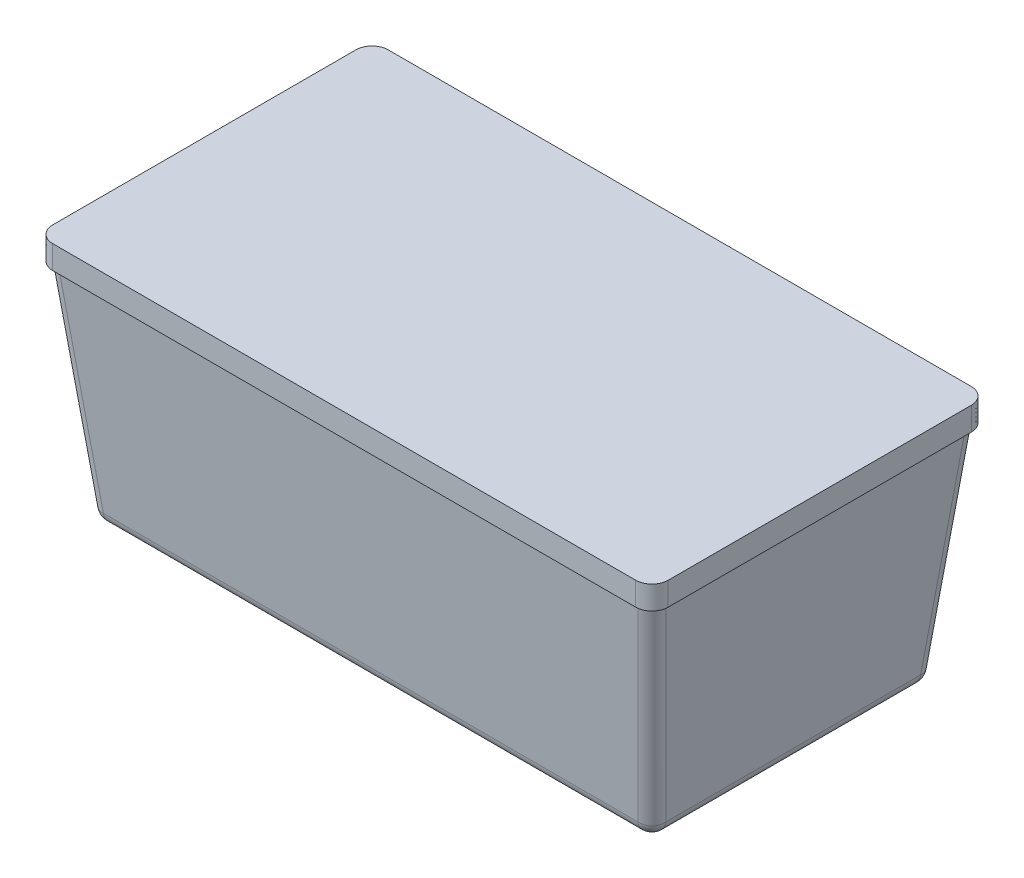
from build123d import *

# Parameters (mm, degrees)
CROQUIS1_W     = 1200
CROQUIS1_H     = 600
EXTRUIR1_DEPTH = 520
EXTRUIR1_DRAFT = -6
REDONDEO1_R    = 30
VACIADO1_T     = -10
EXTRUIR2_DEPTH = 40
EXTRUIR3_DEPTH = 10


with BuildPart() as part:
    # Croquis1 → Extruir1 (with draft: the straight prism first)
    with BuildSketch(Plane(origin=(0, 0, 0), x_dir=(1, 0, 0), z_dir=(0, 1, 0))):
        Rectangle(CROQUIS1_W, CROQUIS1_H)
    extrude(amount=EXTRUIR1_DEPTH)
    # Extruir1: the draft: its side faces are tilted about the plane it starts from
    extruir1_sides = [part.faces().sort_by_distance(p)[0] for p in [
        (600, 260, 0),
        (0, 260, -300),
        (-600, 260, 0),
        (0, 260, 300),
    ]]
    draft(extruir1_sides, Plane(origin=(0, 0, 0), x_dir=(1, 0, 0), z_dir=(0, 1, 0)), EXTRUIR1_DRAFT)

    # Redondeo1
    redondeo1_edges = [part.edges().sort_by_distance(p)[0] for p in [
        (0, 0, -300),
        (600, 0, 0),
        (0, 0, 300),
        (-600, 0, 0),
        (-627.327101169, 260, -327.327101169),
        (627.327101169, 260, -327.327101169),
        (627.327101169, 260, 327.327101169),
        (-627.327101169, 260, 327.327101169),
    ]]
    fillet(redondeo1_edges, radius=REDONDEO1_R)

    # Vaciado1
    vaciado1_openings = [part.faces().sort_by_distance(p)[0] for p in [
        (0, 520, 0),
    ]]
    offset(amount=VACIADO1_T, openings=vaciado1_openings, kind=Kind.INTERSECTION)


with BuildPart() as body_2:
    # Croquis2 → Extruir2 (new body)
    with BuildSketch(Plane(origin=(0, 520, 0), x_dir=(1, 0, 0), z_dir=(0, 1, 0))):
        with BuildLine():
            Line((624.818545477, 359.654202338), (-624.818545477, 359.654202338))
            add(Edge.make_bspline(
                [(-624.818545477, 359.654202338), (-627.120086028, 359.654202338), (-629.380934681, 359.430411757), (-632.713747218, 358.773214804), (-633.814869933, 358.500171352), (-635.451518922, 358.007918705), (-635.994558337, 357.830029047), (-637.075507941, 357.446040848), (-637.613820315, 357.239674494), (-640.2615232, 356.148907719), (-642.265343116, 355.081190983), (-645.10317609, 353.193132085), (-646.020940364, 352.51569528), (-647.353923908, 351.425037779), (-647.790551127, 351.049250723), (-648.639460703, 350.281234378), (-649.053000136, 349.888002267), (-651.066995309, 347.87646125), (-652.507863424, 346.123294027), (-654.41183532, 343.276088185), (-655.005828534, 342.285067005), (-656.083159903, 340.267175368), (-656.568789235, 339.23798924), (-657.870403065, 336.091173443), (-658.532675254, 333.914517133), (-659.430368248, 329.399769105), (-659.654202338, 327.120197811), (-659.654202338, 324.818545477)],
                knots=[0, 0, 0, 0, 0.125, 0.125, 0.1875, 0.1875, 0.21875, 0.21875, 0.25, 0.25, 0.375, 0.375, 0.4375, 0.4375, 0.46875, 0.46875, 0.5, 0.5, 0.625, 0.625, 0.6875, 0.6875, 0.75, 0.75, 0.875, 0.875, 1, 1, 1, 1], degree=3))
            Line((-659.654202338, 324.818545477), (-659.654202338, -324.818545477))
            add(Edge.make_bspline(
                [(-659.654202338, -324.818545477), (-659.654202338, -327.120086028), (-659.430411757, -329.380934681), (-658.773214804, -332.713747218), (-658.500171352, -333.814869933), (-658.007918705, -335.451518922), (-657.830029047, -335.994558337), (-657.446040848, -337.075507941), (-657.239674494, -337.613820315), (-656.148907719, -340.2615232), (-655.081190983, -342.265343116), (-653.193132085, -345.10317609), (-652.51569528, -346.020940364), (-651.425037779, -347.353923908), (-651.049250723, -347.790551127), (-650.281234378, -348.639460703), (-649.888002267, -349.053000136), (-647.87646125, -351.066995309), (-646.123294027, -352.507863424), (-643.276088185, -354.41183532), (-642.285067005, -355.005828534), (-640.267175368, -356.083159903), (-639.23798924, -356.568789235), (-636.091173443, -357.870403065), (-633.914517133, -358.532675254), (-629.399769105, -359.430368248), (-627.120197811, -359.654202338), (-624.818545477, -359.654202338)],
                knots=[0, 0, 0, 0, 0.125, 0.125, 0.1875, 0.1875, 0.21875, 0.21875, 0.25, 0.25, 0.375, 0.375, 0.4375, 0.4375, 0.46875, 0.46875, 0.5, 0.5, 0.625, 0.625, 0.6875, 0.6875, 0.75, 0.75, 0.875, 0.875, 1, 1, 1, 1], degree=3))
            Line((-624.818545477, -359.654202338), (624.818545477, -359.654202338))
            add(Edge.make_bspline(
                [(624.818545477, -359.654202338), (627.120086028, -359.654202338), (629.380934681, -359.430411757), (632.713747218, -358.773214804), (633.814869933, -358.500171352), (635.451518922, -358.007918705), (635.994558337, -357.830029047), (637.075507941, -357.446040848), (637.613820315, -357.239674494), (640.2615232, -356.148907719), (642.265343116, -355.081190983), (645.10317609, -353.193132085), (646.020940364, -352.51569528), (647.353923908, -351.425037779), (647.790551127, -351.049250723), (648.639460703, -350.281234378), (649.053000136, -349.888002267), (651.066995309, -347.87646125), (652.507863424, -346.123294027), (654.41183532, -343.276088185), (655.005828534, -342.285067005), (656.083159903, -340.267175368), (656.568789235, -339.23798924), (657.870403065, -336.091173443), (658.532675254, -333.914517133), (659.430368248, -329.399769105), (659.654202338, -327.120197811), (659.654202338, -324.818545477)],
                knots=[0, 0, 0, 0, 0.125, 0.125, 0.1875, 0.1875, 0.21875, 0.21875, 0.25, 0.25, 0.375, 0.375, 0.4375, 0.4375, 0.46875, 0.46875, 0.5, 0.5, 0.625, 0.625, 0.6875, 0.6875, 0.75, 0.75, 0.875, 0.875, 1, 1, 1, 1], degree=3))
            Line((659.654202338, -324.818545477), (659.654202338, 324.818545477))
            add(Edge.make_bspline(
                [(659.654202338, 324.818545477), (659.654202338, 327.120086028), (659.430411757, 329.380934681), (658.773214804, 332.713747218), (658.500171352, 333.814869933), (658.007918705, 335.451518922), (657.830029047, 335.994558337), (657.446040848, 337.075507941), (657.239674494, 337.613820315), (656.148907719, 340.2615232), (655.081190983, 342.265343116), (653.193132085, 345.10317609), (652.51569528, 346.020940364), (651.425037779, 347.353923908), (651.049250723, 347.790551127), (650.281234378, 348.639460703), (649.888002267, 349.053000136), (647.87646125, 351.066995309), (646.123294027, 352.507863424), (643.276088185, 354.41183532), (642.285067005, 355.005828534), (640.267175368, 356.083159903), (639.23798924, 356.568789235), (636.091173443, 357.870403065), (633.914517133, 358.532675254), (629.399769105, 359.430368248), (627.120197811, 359.654202338), (624.818545477, 359.654202338)],
                knots=[0, 0, 0, 0, 0.125, 0.125, 0.1875, 0.1875, 0.21875, 0.21875, 0.25, 0.25, 0.375, 0.375, 0.4375, 0.4375, 0.46875, 0.46875, 0.5, 0.5, 0.625, 0.625, 0.6875, 0.6875, 0.75, 0.75, 0.875, 0.875, 1, 1, 1, 1], degree=3))
        make_face()
    extrude(amount=-EXTRUIR2_DEPTH)

    # Croquis3 → Extruir3 (add)
    with BuildSketch(Plane(origin=(0, 520, 0), x_dir=(1, 0, 0), z_dir=(0, 1, 0))):
        with BuildLine():
            Line((-659.654202338, 324.818545477), (-659.654202338, -324.818545477))
            add(Edge.make_bspline(
                [(-659.654202338, -324.818545477), (-659.654202338, -327.120086028), (-659.430411757, -329.380934681), (-658.773214804, -332.713747218), (-658.500171352, -333.814869933), (-658.007918705, -335.451518922), (-657.830029047, -335.994558337), (-657.446040848, -337.075507941), (-657.239674494, -337.613820315), (-656.148907719, -340.2615232), (-655.081190983, -342.265343116), (-653.193132085, -345.10317609), (-652.51569528, -346.020940364), (-651.425037779, -347.353923908), (-651.049250723, -347.790551127), (-650.281234378, -348.639460703), (-649.888002267, -349.053000136), (-647.87646125, -351.066995309), (-646.123294027, -352.507863424), (-643.276088185, -354.41183532), (-642.285067005, -355.005828534), (-640.267175368, -356.083159903), (-639.23798924, -356.568789235), (-636.091173443, -357.870403065), (-633.914517133, -358.532675254), (-629.399769105, -359.430368248), (-627.120197811, -359.654202338), (-624.818545477, -359.654202338)],
                knots=[0, 0, 0, 0, 0.125, 0.125, 0.1875, 0.1875, 0.21875, 0.21875, 0.25, 0.25, 0.375, 0.375, 0.4375, 0.4375, 0.46875, 0.46875, 0.5, 0.5, 0.625, 0.625, 0.6875, 0.6875, 0.75, 0.75, 0.875, 0.875, 1, 1, 1, 1], degree=3))
            Line((-624.818545477, -359.654202338), (624.818545477, -359.654202338))
            add(Edge.make_bspline(
                [(624.818545477, -359.654202338), (627.120086028, -359.654202338), (629.380934681, -359.430411757), (632.713747218, -358.773214804), (633.814869933, -358.500171352), (635.451518922, -358.007918705), (635.994558337, -357.830029047), (637.075507941, -357.446040848), (637.613820315, -357.239674494), (640.2615232, -356.148907719), (642.265343116, -355.081190983), (645.10317609, -353.193132085), (646.020940364, -352.51569528), (647.353923908, -351.425037779), (647.790551127, -351.049250723), (648.639460703, -350.281234378), (649.053000136, -349.888002267), (651.066995309, -347.87646125), (652.507863424, -346.123294027), (654.41183532, -343.276088185), (655.005828534, -342.285067005), (656.083159903, -340.267175368), (656.568789235, -339.23798924), (657.870403065, -336.091173443), (658.532675254, -333.914517133), (659.430368248, -329.399769105), (659.654202338, -327.120197811), (659.654202338, -324.818545477)],
                knots=[0, 0, 0, 0, 0.125, 0.125, 0.1875, 0.1875, 0.21875, 0.21875, 0.25, 0.25, 0.375, 0.375, 0.4375, 0.4375, 0.46875, 0.46875, 0.5, 0.5, 0.625, 0.625, 0.6875, 0.6875, 0.75, 0.75, 0.875, 0.875, 1, 1, 1, 1], degree=3))
            Line((659.654202338, -324.818545477), (659.654202338, 324.818545477))
            add(Edge.make_bspline(
                [(659.654202338, 324.818545477), (659.654202338, 327.120086028), (659.430411757, 329.380934681), (658.773214804, 332.713747218), (658.500171352, 333.814869933), (658.007918705, 335.451518922), (657.830029047, 335.994558337), (657.446040848, 337.075507941), (657.239674494, 337.613820315), (656.148907719, 340.2615232), (655.081190983, 342.265343116), (653.193132085, 345.10317609), (652.51569528, 346.020940364), (651.425037779, 347.353923908), (651.049250723, 347.790551127), (650.281234378, 348.639460703), (649.888002267, 349.053000136), (647.87646125, 351.066995309), (646.123294027, 352.507863424), (643.276088185, 354.41183532), (642.285067005, 355.005828534), (640.267175368, 356.083159903), (639.23798924, 356.568789235), (636.091173443, 357.870403065), (633.914517133, 358.532675254), (629.399769105, 359.430368248), (627.120197811, 359.654202338), (624.818545477, 359.654202338)],
                knots=[0, 0, 0, 0, 0.125, 0.125, 0.1875, 0.1875, 0.21875, 0.21875, 0.25, 0.25, 0.375, 0.375, 0.4375, 0.4375, 0.46875, 0.46875, 0.5, 0.5, 0.625, 0.625, 0.6875, 0.6875, 0.75, 0.75, 0.875, 0.875, 1, 1, 1, 1], degree=3))
            Line((624.818545477, 359.654202338), (-624.818545477, 359.654202338))
            add(Edge.make_bspline(
                [(-624.818545477, 359.654202338), (-627.120086028, 359.654202338), (-629.380934681, 359.430411757), (-632.713747218, 358.773214804), (-633.814869933, 358.500171352), (-635.451518922, 358.007918705), (-635.994558337, 357.830029047), (-637.075507941, 357.446040848), (-637.613820315, 357.239674494), (-640.2615232, 356.148907719), (-642.265343116, 355.081190983), (-645.10317609, 353.193132085), (-646.020940364, 352.51569528), (-647.353923908, 351.425037779), (-647.790551127, 351.049250723), (-648.639460703, 350.281234378), (-649.053000136, 349.888002267), (-651.066995309, 347.87646125), (-652.507863424, 346.123294027), (-654.41183532, 343.276088185), (-655.005828534, 342.285067005), (-656.083159903, 340.267175368), (-656.568789235, 339.23798924), (-657.870403065, 336.091173443), (-658.532675254, 333.914517133), (-659.430368248, 329.399769105), (-659.654202338, 327.120197811), (-659.654202338, 324.818545477)],
                knots=[0, 0, 0, 0, 0.125, 0.125, 0.1875, 0.1875, 0.21875, 0.21875, 0.25, 0.25, 0.375, 0.375, 0.4375, 0.4375, 0.46875, 0.46875, 0.5, 0.5, 0.625, 0.625, 0.6875, 0.6875, 0.75, 0.75, 0.875, 0.875, 1, 1, 1, 1], degree=3))
        make_face()
    extrude(amount=EXTRUIR3_DEPTH)


solid = Compound([part.part, body_2.part])
